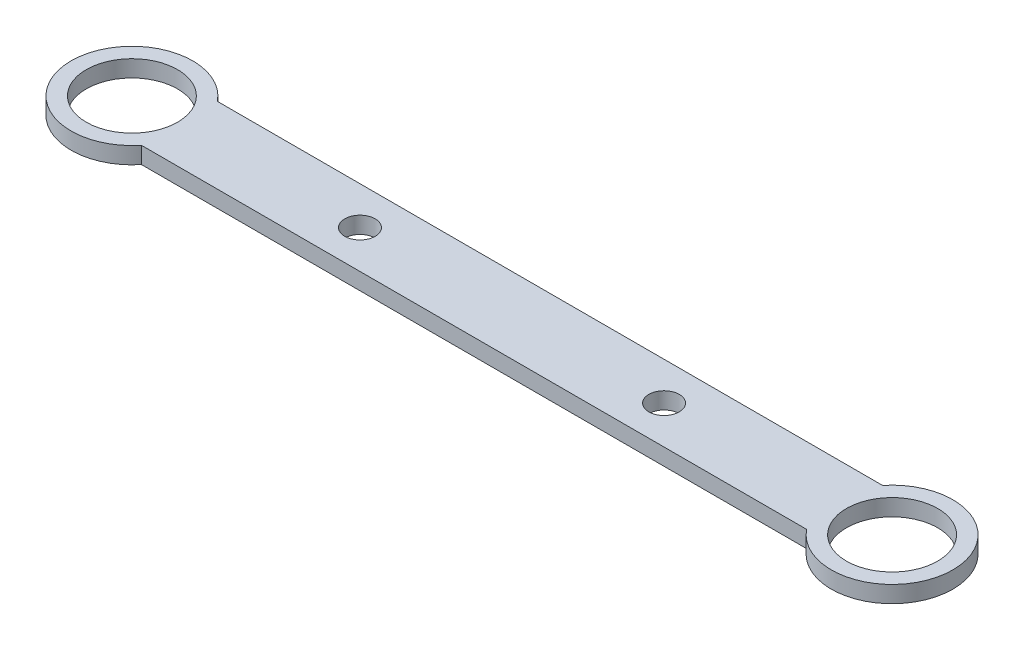
from build123d import *

# Parameters (mm, degrees)
SKETCH_4_R      = 1
SKETCH_4_R_2    = 3
EXTRUDE_1_DEPTH = 1.1


with BuildPart() as part:
    # 草图4 → 凸台-拉伸1 (new body)
    with BuildSketch(Plane(origin=(0, 0, 0), x_dir=(1, 0, 0), z_dir=(0, 1, 0))):
        with BuildLine():
            Line((3.122498999, -2.5), (46.877501001, -2.5))
            ThreePointArc((46.877501001, -2.5), (54, 0), (46.877501001, 2.5))
            Line((46.877501001, 2.5), (3.122498999, 2.5))
            ThreePointArc((3.122498999, 2.5), (-4, 0), (3.122498999, -2.5))
        make_face()
        with Locations(Location((15, 0, 0), (0, 0, 270))):
            Circle(SKETCH_4_R, mode=Mode.SUBTRACT)
        with Locations(Location((35, 0, 0), (0, 0, 270))):
            Circle(SKETCH_4_R, mode=Mode.SUBTRACT)
        with Locations(Location((0, 0, 0), (0, 0, 270))):
            Circle(SKETCH_4_R_2, mode=Mode.SUBTRACT)
        with Locations(Location((50, 0, 0), (0, 0, 270))):
            Circle(SKETCH_4_R_2, mode=Mode.SUBTRACT)
    extrude(amount=EXTRUDE_1_DEPTH)


solid = part.part
